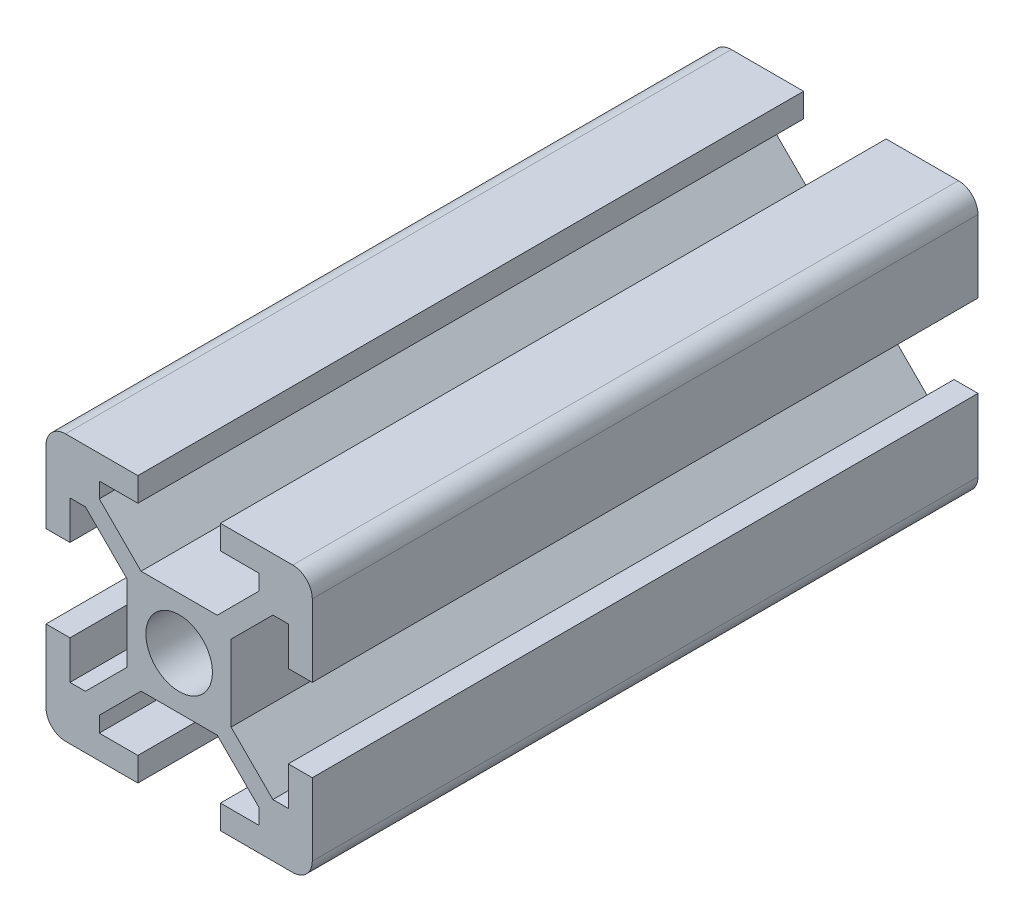
from build123d import *

# Parameters (mm, degrees)
SKETCH1_R           = 2.5
BOSS_EXTRUDE1_DEPTH = 50
FILLET1_R           = 1.47
SKETCH2_R           = 1.5
CUT_EXTRUDE1_DEPTH  = 53.850827808
SKETCH3_R           = 1.5
CUT_EXTRUDE2_DEPTH  = 53.850827903


with BuildPart() as part:
    # Sketch1 → Boss-Extrude1 (new body)
    with BuildSketch(Plane.XY):
        Polygon((2.860553032, 3.9), (6, 7.039446968), (6, 8.2), (3.1, 8.2), (3.1, 10), (10, 10), (10, 3.1), (8.2, 3.1), (8.2, 6), (7.039446968, 6), (3.9, 2.860553032), (3.9, 0), (3.9, -2.860553032), (7.039446968, -6), (8.2, -6), (8.2, -3.1), (10, -3.1), (10, -10), (3.1, -10), (3.1, -8.2), (6, -8.2), (6, -7.039446968), (2.860553032, -3.9), (0, -3.9), (-2.860553032, -3.9), (-6, -7.039446968), (-6, -8.2), (-3.1, -8.2), (-3.1, -10), (-10, -10), (-10, -3.1), (-8.2, -3.1), (-8.2, -6), (-7.039446968, -6), (-3.9, -2.860553032), (-3.9, 0), (-3.9, 2.860553032), (-7.039446968, 6), (-8.2, 6), (-8.2, 3.1), (-10, 3.1), (-10, 10), (-3.1, 10), (-3.1, 8.2), (-6, 8.2), (-6, 7.039446968), (-2.860553032, 3.9), (0, 3.9), align=None)
        Circle(SKETCH1_R, mode=Mode.SUBTRACT)
    extrude(amount=BOSS_EXTRUDE1_DEPTH)

    # Fillet1
    fillet1_edges = [part.edges().sort_by_distance(p)[0] for p in [
        (10, -10, 25),
        (-10, -10, 25),
        (-10, 10, 25),
        (10, 10, 25),
    ]]
    fillet(fillet1_edges, radius=FILLET1_R)

    # Sketch2 → Cut-Extrude1 (cut, through all)
    with BuildSketch(Plane.XZ.offset(3.9)):
        with Locations((0, 40)):
            Circle(SKETCH2_R)
    extrude(amount=-CUT_EXTRUDE1_DEPTH, mode=Mode.SUBTRACT)

    # Sketch3 → Cut-Extrude2 (cut, through all)
    with BuildSketch(Plane(origin=(0, 3.9, 0), x_dir=(1, 0, 0), z_dir=(0, 1, 0))):
        with Locations(Location((0, -10, 0), (0, 0, 180))):
            Circle(SKETCH3_R)
    extrude(amount=-CUT_EXTRUDE2_DEPTH, mode=Mode.SUBTRACT)


solid = part.part
